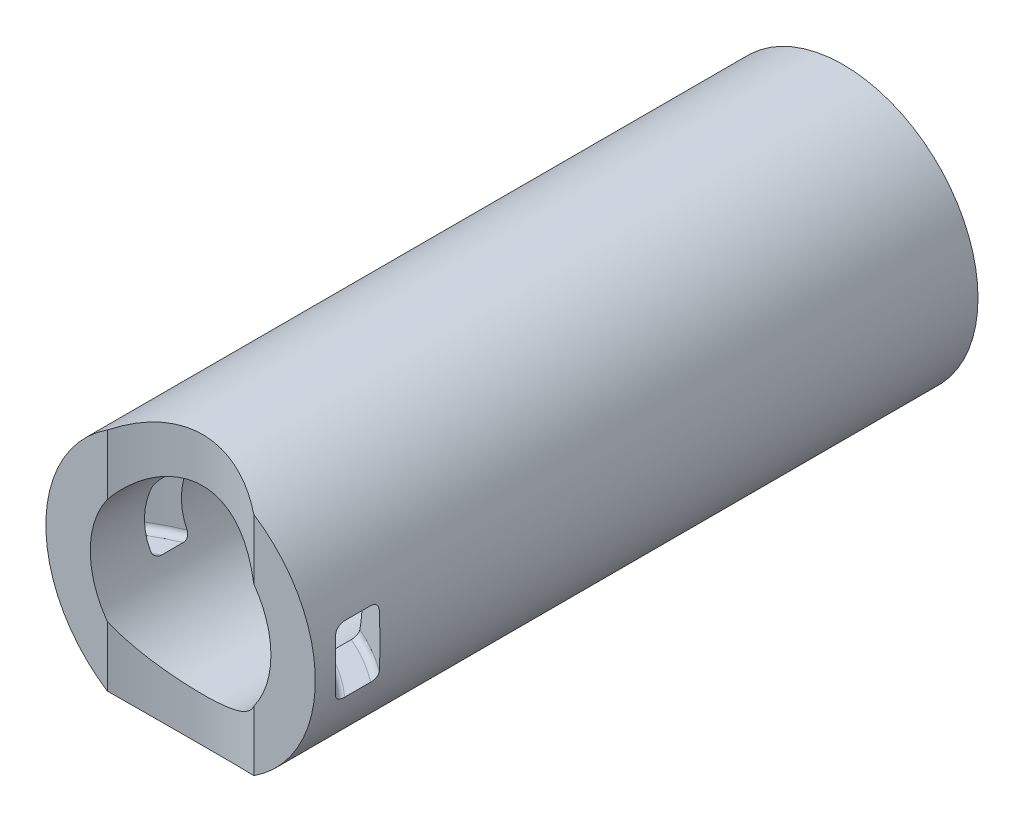
from build123d import *

# Parameters (mm, degrees)
SKETCH1_R               = 6.1
SKETCH1_R_2             = 1.65
BOSS_EXTRUDE1_DEPTH     = 30
SKETCH2_R               = 3.69
CUT_EXTRUDE1_DEPTH      = 4
SKETCH3_R               = 4.09
CUT_EXTRUDE3_DEPTH      = 22
CUT_EXTRUDE4_DEPTH      = 32.215701177
CUT_EXTRUDE4_DEPTH_BACK = 32.215701177
SKETCH4_R               = 6


with BuildPart() as part:
    # Sketch1 → Boss-Extrude1 (new body)
    with BuildSketch(Plane.XY):
        Circle(SKETCH1_R)
        Circle(SKETCH1_R_2, mode=Mode.SUBTRACT)
    extrude(amount=BOSS_EXTRUDE1_DEPTH)

    # Sketch2 → Cut-Extrude1 (cut)
    with BuildSketch(Plane(origin=(0, 0, 0), x_dir=(-1, 0, 0), z_dir=(0, 0, -1))):
        Circle(SKETCH2_R)
    extrude(amount=-CUT_EXTRUDE1_DEPTH, mode=Mode.SUBTRACT)

    # Sketch3 → Cut-Extrude3 (cut)
    with BuildSketch(Plane.XY.offset(30)):
        Circle(SKETCH3_R)
    extrude(amount=-CUT_EXTRUDE3_DEPTH, mode=Mode.SUBTRACT)

    # Sketch4 → Cut-Extrude4 (cut, two sides: drawn at the far end of the back side and taken through both)
    with BuildSketch(Plane(origin=(0, 0, 0), x_dir=(1, 0, 0), z_dir=(0, 1, 0)).offset(-CUT_EXTRUDE4_DEPTH_BACK)):
        with Locations((0, -35)):
            Circle(SKETCH4_R)
    extrude(amount=CUT_EXTRUDE4_DEPTH + CUT_EXTRUDE4_DEPTH_BACK, mode=Mode.SUBTRACT)

    # Sketch7 → Cut-Revolve1 (revolve, cut)
    with BuildSketch(Plane.XY.offset(35)):
        with BuildLine():
            Line((-9.7, 1.5), (-8.8, 1.5))
            ThreePointArc((-8.8, 1.5), (-8.587867966, 1.412132034), (-8.5, 1.2))
            Line((-8.5, 1.2), (-8.5, -1.2))
            ThreePointArc((-8.5, -1.2), (-8.587867966, -1.412132034), (-8.8, -1.5))
            Line((-8.8, -1.5), (-9.7, -1.5))
            ThreePointArc((-9.7, -1.5), (-9.912132034, -1.412132034), (-10, -1.2))
            Line((-10, -1.2), (-10, 1.2))
            ThreePointArc((-10, 1.2), (-9.912132034, 1.412132034), (-9.7, 1.5))
        make_face()
    revolve(axis=Axis((0, 6.1, 35), (0, -1, 0)), mode=Mode.SUBTRACT)


solid = part.part
